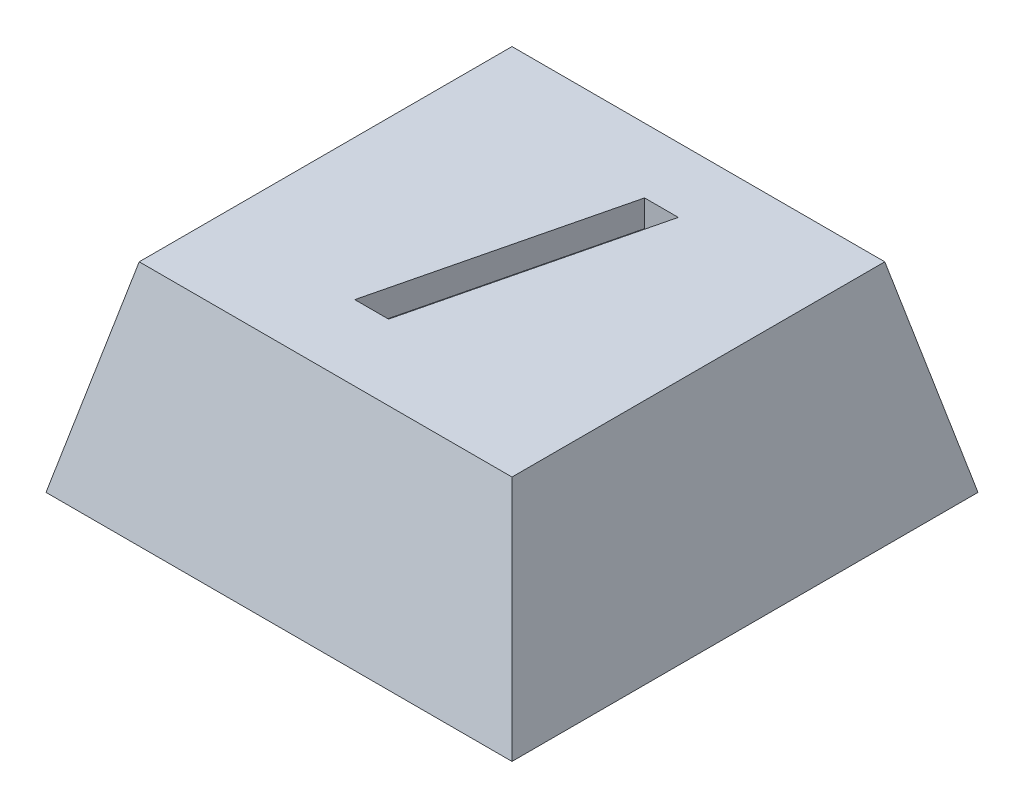
from build123d import *

# Parameters (mm, degrees)
SKETCH1_W           = 7
SKETCH1_H           = 7
BOSS_EXTRUDE1_DEPTH = 3
CUT_EXTRUDE1_DEPTH  = 7
CUT_EXTRUDE2_DEPTH  = 11
SKETCH4_R           = 1.8
CUT_EXTRUDE3_DEPTH  = 0.8
CUT_EXTRUDE4_DEPTH  = 0.4


with BuildPart() as part:
    # Sketch1 → Boss-Extrude1 (new body)
    with BuildSketch(Plane(origin=(0, 0, 0), x_dir=(1, 0, 0), z_dir=(0, 1, 0))):
        with Locations((3.5, 3.5)):
            Rectangle(SKETCH1_W, SKETCH1_H)
    extrude(amount=BOSS_EXTRUDE1_DEPTH)

    # Sketch2 → Cut-Extrude1 (cut)
    with BuildSketch(Plane.XY):
        Polygon((0, 0), (0.7, 3), (0, 3), align=None)
        Polygon((7, 0), (6.3, 3), (7, 3), align=None)
    extrude(amount=-CUT_EXTRUDE1_DEPTH, mode=Mode.SUBTRACT)

    # Sketch3 → Cut-Extrude2 (cut)
    with BuildSketch(Plane(origin=(0, 0, 0), x_dir=(0, 0, -1), z_dir=(1, 0, 0))):
        Polygon((0, 0), (0.7, 3), (0, 3), align=None)
        Polygon((7, 3), (6.3, 3), (7, 0), align=None)
    extrude(amount=CUT_EXTRUDE2_DEPTH, mode=Mode.SUBTRACT)

    # Sketch4 → Cut-Extrude3 (cut)
    with BuildSketch(Plane.XZ):
        with Locations(Location((3.5, -3.5, 0), (0, 0, 270))):
            Circle(SKETCH4_R)
    extrude(amount=-CUT_EXTRUDE3_DEPTH, mode=Mode.SUBTRACT)

    # Sketch6 → Cut-Extrude4 (cut)
    with BuildSketch(Plane(origin=(0, 3, 0), x_dir=(1, 0, 0), z_dir=(0, 1, 0))):
        Polygon((2.811280801, 1.826752028), (3.664546025, 5.326752028), (4.171457083, 5.326752028), (3.318892981, 1.826752028), align=None)
    extrude(amount=-CUT_EXTRUDE4_DEPTH, mode=Mode.SUBTRACT)


solid = part.part
